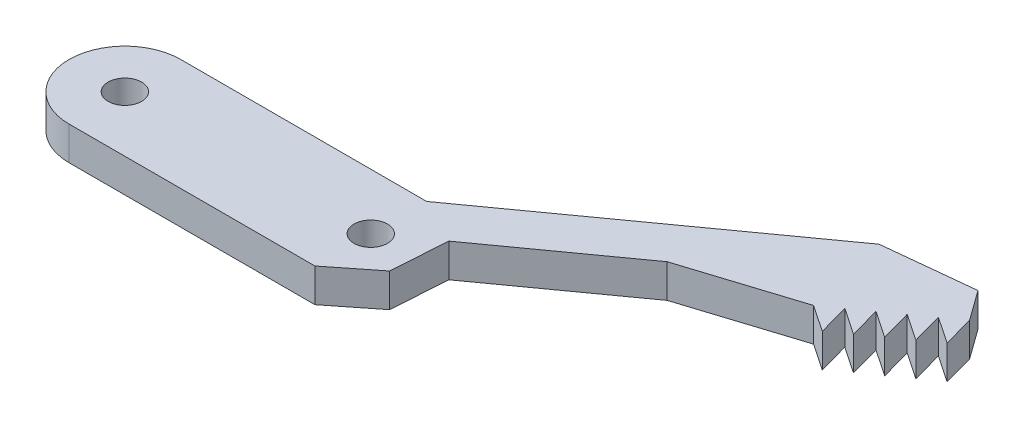
from build123d import *

# Parameters (mm, degrees)
IZIM2_R                     = 1.5
Y_KSEKLIK_EKSTR_ZYON1_DEPTH = 3
Y_KSEKLIK_EKSTR_ZYON2_START = -3
Y_KSEKLIK_EKSTR_ZYON2_DEPTH = 3
KES_EKSTR_ZYON1_DEPTH       = 3
KES_EKSTR_ZYON2_DEPTH       = 3
KES_EKSTR_ZYON3_DEPTH       = 3


with BuildPart() as part:
    # Çizim2 → Yükseklik-Ekstrüzyon1 (new body)
    with BuildSketch(Plane(origin=(0, 0, 0), x_dir=(1, 0, 0), z_dir=(0, 1, 0))):
        with BuildLine():
            Line((-11, 5), (11, 5))
            ThreePointArc((11, 5), (16, 0), (11, -5))
            Line((11, -5), (-11, -5))
            ThreePointArc((-11, -5), (-16, 0), (-11, 5))
        make_face()
        with Locations(Location((-11, 0, 0), (0, 0, 270))):
            Circle(IZIM2_R, mode=Mode.SUBTRACT)
        with Locations(Location((11, 0, 0), (0, 0, 270))):
            Circle(IZIM2_R, mode=Mode.SUBTRACT)
    extrude(amount=Y_KSEKLIK_EKSTR_ZYON1_DEPTH)

    # Çizim3 → Yükseklik-Ekstrüzyon2 (add)
    with BuildSketch(Plane(origin=(0, 3, 0), x_dir=(1, 0, 0), z_dir=(0, 1, 0)).offset(Y_KSEKLIK_EKSTR_ZYON2_START)):
        with BuildLine():
            Line((11, 5), (40.233453571, 26.009645221))
            Line((40.233453571, 26.009645221), (46.069466132, 17.889241451))
            Line((46.069466132, 17.889241451), (37.949062363, 12.05322889))
            Line((37.949062363, 12.05322889), (36.369445688, 14.251155139))
            Line((36.369445688, 14.251155139), (26.428767162, 11.088423867))
            Line((26.428767162, 11.088423867), (15.060201885, 2.918006281))
            ThreePointArc((15.060201885, 2.918006281), (13.281443468, 4.449158988), (11, 5))
        make_face()
    extrude(amount=Y_KSEKLIK_EKSTR_ZYON2_DEPTH)

    # Çizim4 → Kes-Ekstrüzyon1 (cut)
    with BuildSketch(Plane(origin=(0, 3, 0), x_dir=(1, 0, 0), z_dir=(0, 1, 0))):
        Polygon((34.549170932, 21.924436428), (40.233453571, 26.009645221), (42.567858595, 22.761483713), align=None)
    extrude(amount=-KES_EKSTR_ZYON1_DEPTH, mode=Mode.SUBTRACT)

    # Çizim5 → Kes-Ekstrüzyon2 (cut)
    with BuildSketch(Plane(origin=(0, 3, 0), x_dir=(1, 0, 0), z_dir=(0, 1, 0))):
        Polygon((38.76110274, 12.636830146), (36.369445688, 14.251155139), (37.949062363, 12.05322889), align=None)
        Polygon((37.993526442, 15.418357651), (38.76110274, 12.636830146), (40.385183494, 13.804032658), align=None)
        Polygon((39.617607196, 16.585560164), (40.385183494, 13.804032658), (42.009264247, 14.971235171), align=None)
        Polygon((41.24168795, 17.752762676), (42.009264247, 14.971235171), (43.633345001, 16.138437683), align=None)
        Polygon((42.865768704, 18.919965188), (43.633345001, 16.138437683), (45.257425755, 17.305640195), align=None)
        Polygon((44.489849458, 20.0871677), (45.257425755, 17.305640195), (46.069466132, 17.889241451), align=None)
    extrude(amount=-KES_EKSTR_ZYON2_DEPTH, mode=Mode.SUBTRACT)

    # Çizim6 → Kes-Ekstrüzyon3 (cut)
    with BuildSketch(Plane(origin=(0, 3, 0), x_dir=(1, 0, 0), z_dir=(0, 1, 0))):
        Polygon((15.060201885, 2.918006281), (14.736771564, -2.041177089), (11, -5), (11, -9.807776343), (27.690155634, -9.807776343), (28.885017057, 0.673945989), align=None)
    extrude(amount=-KES_EKSTR_ZYON3_DEPTH, mode=Mode.SUBTRACT)


solid = part.part
